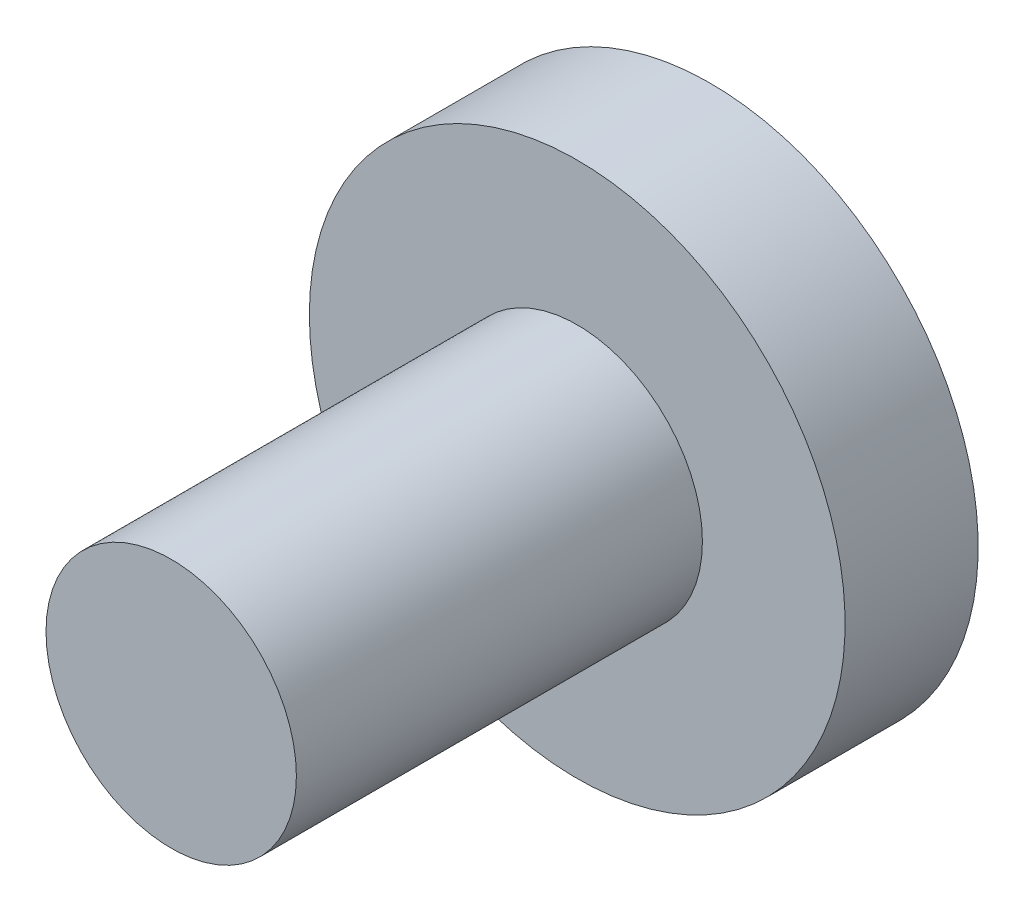
from build123d import *

# Parameters (mm, degrees)
SKETCH1_R           = 6.0325
BOSS_EXTRUDE1_DEPTH = 2.9972
SKETCH2_R           = 2.8194
BOSS_EXTRUDE2_DEPTH = 9.144


with BuildPart() as part:
    # Sketch1 → Boss-Extrude1 (new body)
    with BuildSketch(Plane.XY):
        with Locations(Location((-3.569250295, 4.794697539, 0), (0, 0, 180))):
            Circle(SKETCH1_R)
    extrude(amount=BOSS_EXTRUDE1_DEPTH)

    # Sketch2 → Boss-Extrude2 (add)
    with BuildSketch(Plane.XY.offset(2.9972)):
        with Locations((-3.569250295, 4.794697539)):
            Circle(SKETCH2_R)
    extrude(amount=BOSS_EXTRUDE2_DEPTH)


solid = part.part
